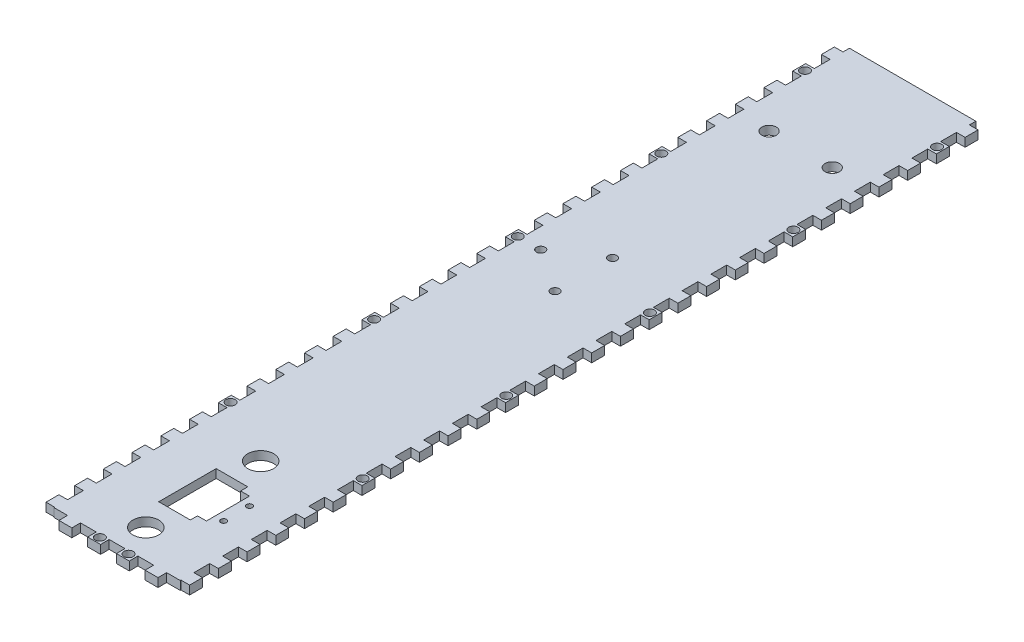
from build123d import *

# Parameters (mm, degrees)
SKETCH1_W               = 44
SKETCH1_H               = 3
BOSS_EXTRUDE1_DEPTH     = 277
SKETCH4_W               = 4.5
SKETCH4_H               = 3
BOSS_EXTRUDE2_DEPTH     = 3
SKETCH5_W               = 4.5
SKETCH5_H               = 3
BOSS_EXTRUDE3_DEPTH     = 3
SKETCH6_W               = 4.5
SKETCH6_H               = 3
BOSS_EXTRUDE4_DEPTH     = 3
SKETCH7_R               = 1.6
CUT_EXTRUDE1_DEPTH      = 3
SKETCH8_R               = 2.5
CUT_EXTRUDE2_DEPTH      = 12
SKETCH9_R               = 1.6
CUT_EXTRUDE3_DEPTH      = 12
SKETCH11_W              = 11
SKETCH11_H              = 20
SKETCH11_W_2            = 3.1
SKETCH11_H_2            = 15
SKETCH11_R              = 4.5
SKETCH11_R_2            = 1
CUT_EXTRUDE4_DEPTH      = 282.956246282
SKETCH7_2_R             = 1.6
BOSS_EXTRUDE5_DEPTH     = 3
CUT_EXTRUDE5_DEPTH      = 282.956246282
CUT_EXTRUDE5_DEPTH_BACK = 282.956246282
SKETCH12_R              = 1.5


with BuildPart() as part:
    # Sketch1 → Boss-Extrude1 (new body)
    with BuildSketch(Plane.XY):
        with Locations((-8.02006689, 9.02173913)):
            Rectangle(SKETCH1_W, SKETCH1_H)
    extrude(amount=BOSS_EXTRUDE1_DEPTH)

    # Sketch4 → Boss-Extrude2 (add)
    with BuildSketch(Plane(origin=(13.97993311, 0, 0), x_dir=(0, 0, -1), z_dir=(1, 0, 0))):
        with Locations((-274.5, 9.02173913)):
            Rectangle(SKETCH4_W, SKETCH4_H)
        with Locations((-264.5, 9.02173913)):
            Rectangle(SKETCH4_W, SKETCH4_H)
        with Locations((-254.5, 9.02173913)):
            Rectangle(SKETCH4_W, SKETCH4_H)
        with Locations((-244.5, 9.02173913)):
            Rectangle(SKETCH4_W, SKETCH4_H)
        with Locations((-234.5, 9.02173913)):
            Rectangle(SKETCH4_W, SKETCH4_H)
        with Locations((-224.5, 9.02173913)):
            Rectangle(SKETCH4_W, SKETCH4_H)
        with Locations((-214.5, 9.02173913)):
            Rectangle(SKETCH4_W, SKETCH4_H)
        with Locations((-204.5, 9.02173913)):
            Rectangle(SKETCH4_W, SKETCH4_H)
        with Locations((-194.5, 9.02173913)):
            Rectangle(SKETCH4_W, SKETCH4_H)
        with Locations((-184.5, 9.02173913)):
            Rectangle(SKETCH4_W, SKETCH4_H)
        with Locations((-174.5, 9.02173913)):
            Rectangle(SKETCH4_W, SKETCH4_H)
        with Locations((-164.5, 9.02173913)):
            Rectangle(SKETCH4_W, SKETCH4_H)
        with Locations((-154.5, 9.02173913)):
            Rectangle(SKETCH4_W, SKETCH4_H)
        with Locations((-144.5, 9.02173913)):
            Rectangle(SKETCH4_W, SKETCH4_H)
        with Locations((-134.5, 9.02173913)):
            Rectangle(SKETCH4_W, SKETCH4_H)
        with Locations((-124.5, 9.02173913)):
            Rectangle(SKETCH4_W, SKETCH4_H)
        with Locations((-114.5, 9.02173913)):
            Rectangle(SKETCH4_W, SKETCH4_H)
        with Locations((-104.5, 9.02173913)):
            Rectangle(SKETCH4_W, SKETCH4_H)
        with Locations((-94.5, 9.02173913)):
            Rectangle(SKETCH4_W, SKETCH4_H)
        with Locations((-84.5, 9.02173913)):
            Rectangle(SKETCH4_W, SKETCH4_H)
        with Locations((-74.5, 9.02173913)):
            Rectangle(SKETCH4_W, SKETCH4_H)
        with Locations((-64.5, 9.02173913)):
            Rectangle(SKETCH4_W, SKETCH4_H)
        with Locations((-54.5, 9.02173913)):
            Rectangle(SKETCH4_W, SKETCH4_H)
        with Locations((-44.5, 9.02173913)):
            Rectangle(SKETCH4_W, SKETCH4_H)
        with Locations((-34.5, 9.02173913)):
            Rectangle(SKETCH4_W, SKETCH4_H)
        with Locations((-24.5, 9.02173913)):
            Rectangle(SKETCH4_W, SKETCH4_H)
        with Locations((-14.5, 9.02173913)):
            Rectangle(SKETCH4_W, SKETCH4_H)
        with Locations((-4.5, 9.02173913)):
            Rectangle(SKETCH4_W, SKETCH4_H)
    extrude(amount=BOSS_EXTRUDE2_DEPTH)

    # Sketch5 → Boss-Extrude3 (add)
    with BuildSketch(Plane.ZY.offset(30.02006689)):
        with Locations((274.5, 9.02173913)):
            Rectangle(SKETCH5_W, SKETCH5_H)
        with Locations((264.5, 9.02173913)):
            Rectangle(SKETCH5_W, SKETCH5_H)
        with Locations((254.5, 9.02173913)):
            Rectangle(SKETCH5_W, SKETCH5_H)
        with Locations((244.5, 9.02173913)):
            Rectangle(SKETCH5_W, SKETCH5_H)
        with Locations((234.5, 9.02173913)):
            Rectangle(SKETCH5_W, SKETCH5_H)
        with Locations((224.5, 9.02173913)):
            Rectangle(SKETCH5_W, SKETCH5_H)
        with Locations((214.5, 9.02173913)):
            Rectangle(SKETCH5_W, SKETCH5_H)
        with Locations((204.5, 9.02173913)):
            Rectangle(SKETCH5_W, SKETCH5_H)
        with Locations((194.5, 9.02173913)):
            Rectangle(SKETCH5_W, SKETCH5_H)
        with Locations((184.5, 9.02173913)):
            Rectangle(SKETCH5_W, SKETCH5_H)
        with Locations((174.5, 9.02173913)):
            Rectangle(SKETCH5_W, SKETCH5_H)
        with Locations((164.5, 9.02173913)):
            Rectangle(SKETCH5_W, SKETCH5_H)
        with Locations((154.5, 9.02173913)):
            Rectangle(SKETCH5_W, SKETCH5_H)
        with Locations((144.5, 9.02173913)):
            Rectangle(SKETCH5_W, SKETCH5_H)
        with Locations((134.5, 9.02173913)):
            Rectangle(SKETCH5_W, SKETCH5_H)
        with Locations((124.5, 9.02173913)):
            Rectangle(SKETCH5_W, SKETCH5_H)
        with Locations((114.5, 9.02173913)):
            Rectangle(SKETCH5_W, SKETCH5_H)
        with Locations((104.5, 9.02173913)):
            Rectangle(SKETCH5_W, SKETCH5_H)
        with Locations((94.5, 9.02173913)):
            Rectangle(SKETCH5_W, SKETCH5_H)
        with Locations((84.5, 9.02173913)):
            Rectangle(SKETCH5_W, SKETCH5_H)
        with Locations((74.5, 9.02173913)):
            Rectangle(SKETCH5_W, SKETCH5_H)
        with Locations((64.5, 9.02173913)):
            Rectangle(SKETCH5_W, SKETCH5_H)
        with Locations((54.5, 9.02173913)):
            Rectangle(SKETCH5_W, SKETCH5_H)
        with Locations((44.5, 9.02173913)):
            Rectangle(SKETCH5_W, SKETCH5_H)
        with Locations((34.5, 9.02173913)):
            Rectangle(SKETCH5_W, SKETCH5_H)
        with Locations((24.5, 9.02173913)):
            Rectangle(SKETCH5_W, SKETCH5_H)
        with Locations((14.5, 9.02173913)):
            Rectangle(SKETCH5_W, SKETCH5_H)
        with Locations((4.5, 9.02173913)):
            Rectangle(SKETCH5_W, SKETCH5_H)
    extrude(amount=BOSS_EXTRUDE3_DEPTH)

    # Sketch6 → Boss-Extrude4 (add)
    with BuildSketch(Plane.XY.offset(277)):
        with Locations((-23.02006689, 9.02173913)):
            Rectangle(SKETCH6_W, SKETCH6_H)
        with Locations((-13.02006689, 9.02173913)):
            Rectangle(SKETCH6_W, SKETCH6_H)
        with Locations((-3.02006689, 9.02173913)):
            Rectangle(SKETCH6_W, SKETCH6_H)
        with Locations((6.97993311, 9.02173913)):
            Rectangle(SKETCH6_W, SKETCH6_H)
    extrude(amount=BOSS_EXTRUDE4_DEPTH)

    # Sketch7 → Cut-Extrude1 (cut)
    with BuildSketch(Plane.XZ.offset(-7.52173913)):
        with Locations(Location((14.97993311, 264.5, 0), (0, 0, 270))):
            Circle(SKETCH7_R)
        with Locations(Location((-31.02006689, 264.5, 0), (0, 0, 90))):
            Circle(SKETCH7_R)
        with Locations(Location((-31.02006689, 214.5, 0), (0, 0, 90))):
            Circle(SKETCH7_R)
        with Locations(Location((14.97993311, 214.5, 0), (0, 0, 270))):
            Circle(SKETCH7_R)
        with Locations(Location((-31.02006689, 164.5, 0), (0, 0, 90))):
            Circle(SKETCH7_R)
        with Locations(Location((14.97993311, 164.5, 0), (0, 0, 270))):
            Circle(SKETCH7_R)
        with Locations(Location((-31.02006689, 114.5, 0), (0, 0, 90))):
            Circle(SKETCH7_R)
        with Locations(Location((14.97993311, 114.5, 0), (0, 0, 270))):
            Circle(SKETCH7_R)
        with Locations(Location((-31.02006689, 64.5, 0), (0, 0, 90))):
            Circle(SKETCH7_R)
        with Locations(Location((14.97993311, 64.5, 0), (0, 0, 270))):
            Circle(SKETCH7_R)
        with Locations(Location((-31.02006689, 14.5, 0), (0, 0, 90))):
            Circle(SKETCH7_R)
        with Locations(Location((14.97993311, 14.5, 0), (0, 0, 270))):
            Circle(SKETCH7_R)
    extrude(amount=-CUT_EXTRUDE1_DEPTH, mode=Mode.SUBTRACT)

    # Sketch8 → Cut-Extrude2 (cut)
    with BuildSketch(Plane.XZ.offset(-7.52173913)):
        with Locations(Location((-19.02006689, 39, 0), (0, 0, 270))):
            Circle(SKETCH8_R)
        with Locations(Location((2.97993311, 39, 0), (0, 0, 270))):
            Circle(SKETCH8_R)
    extrude(amount=-CUT_EXTRUDE2_DEPTH, mode=Mode.SUBTRACT)

    # Sketch9 → Cut-Extrude3 (cut)
    with BuildSketch(Plane(origin=(0, 7.52173913, 0), x_dir=(-1, 0, 0), z_dir=(0, -1, 0))):
        with Locations(Location((13.02006689, -278, 0), (0, 0, 90))):
            Circle(SKETCH9_R)
        with Locations(Location((3.02006689, -278, 0), (0, 0, 90))):
            Circle(SKETCH9_R)
    extrude(amount=-CUT_EXTRUDE3_DEPTH, mode=Mode.SUBTRACT)

    # Sketch11 → Cut-Extrude4 (cut, through all)
    with BuildSketch(Plane.XZ.offset(-7.52173913)):
        with Locations((-8.02006689, 247)):
            Rectangle(SKETCH11_W, SKETCH11_H)
        with Locations((-0.97006689, 247)):
            Rectangle(SKETCH11_W_2, SKETCH11_H_2)
        with Locations(Location((-8.02006689, 267, 0), (0, 0, 270))):
            Circle(SKETCH11_R)
        with Locations(Location((-8.02006689, 227, 0), (0, 0, 270))):
            Circle(SKETCH11_R)
        with Locations(Location((3.57993311, 251.5, 0), (0, 0, 270))):
            Circle(SKETCH11_R_2)
        with Locations(Location((3.57993311, 242.5, 0), (0, 0, 270))):
            Circle(SKETCH11_R_2)
    extrude(amount=-CUT_EXTRUDE4_DEPTH, mode=Mode.SUBTRACT)

    # Sketch7<2> → Boss-Extrude5 (add, through all)
    with BuildSketch(Plane.XZ.offset(-7.52173913)):
        with Locations((-31.02006689, 264.5)):
            Circle(SKETCH7_2_R)
        with Locations((14.97993311, 264.5)):
            Circle(SKETCH7_2_R)
    extrude(amount=-BOSS_EXTRUDE5_DEPTH)

    # Sketch12 → Cut-Extrude5 (cut, two sides: drawn at the far end of the back side and taken through both)
    with BuildSketch(Plane(origin=(0, 10.52173913, 0), x_dir=(1, 0, 0), z_dir=(0, 1, 0)).offset(-CUT_EXTRUDE5_DEPTH_BACK)):
        with Locations(Location((-8.02006689, -124.5, 0), (0, 0, 270))):
            Circle(SKETCH12_R)
        with Locations(Location((-8.02006689, -104.5, 0), (0, 0, 270))):
            Circle(SKETCH12_R)
        with Locations(Location((-23.02006689, -114.5, 0), (0, 0, 270))):
            Circle(SKETCH12_R)
    extrude(amount=CUT_EXTRUDE5_DEPTH + CUT_EXTRUDE5_DEPTH_BACK, mode=Mode.SUBTRACT)


solid = part.part
